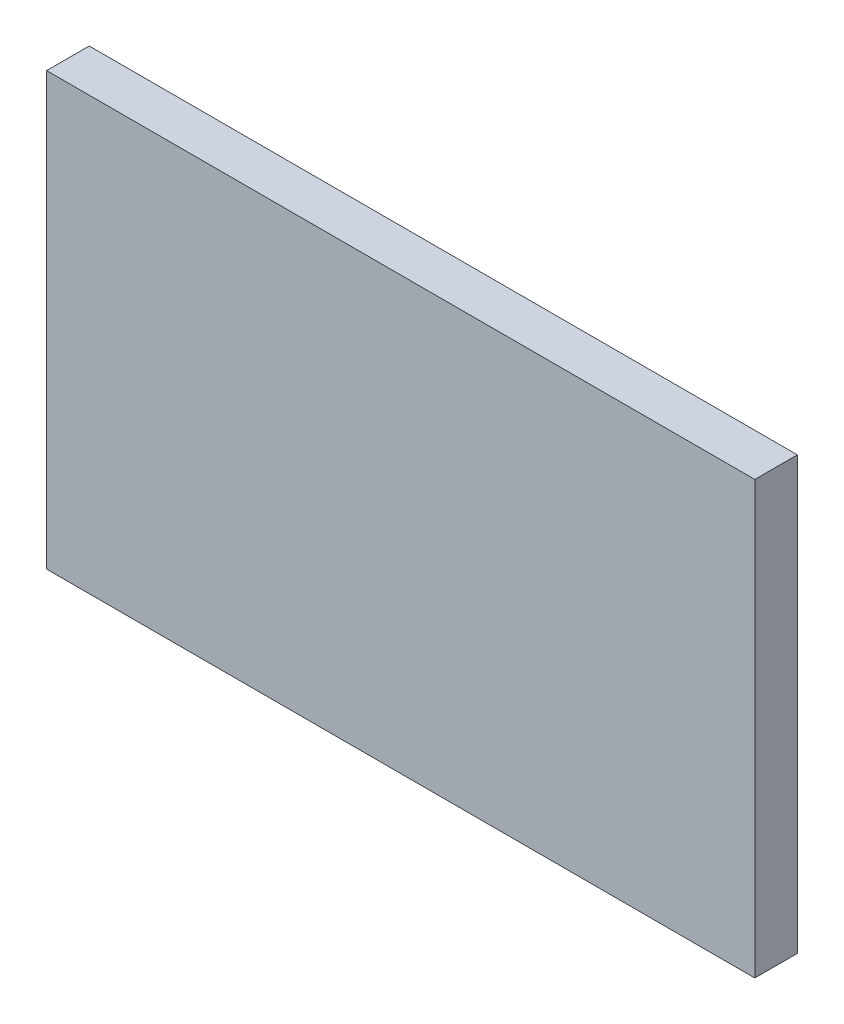
from build123d import *

# Parameters (mm, degrees)
ESBO_O1_W                = 166.3
ESBO_O1_H                = 101.4
RESSALTO_EXTRUS_O1_DEPTH = 10


with BuildPart() as part:
    # Esboço1 → Ressalto-extrusão1 (new body)
    with BuildSketch(Plane.XY):
        with Locations((83.15, 50.7)):
            Rectangle(ESBO_O1_W, ESBO_O1_H)
    extrude(amount=RESSALTO_EXTRUS_O1_DEPTH)


solid = part.part
